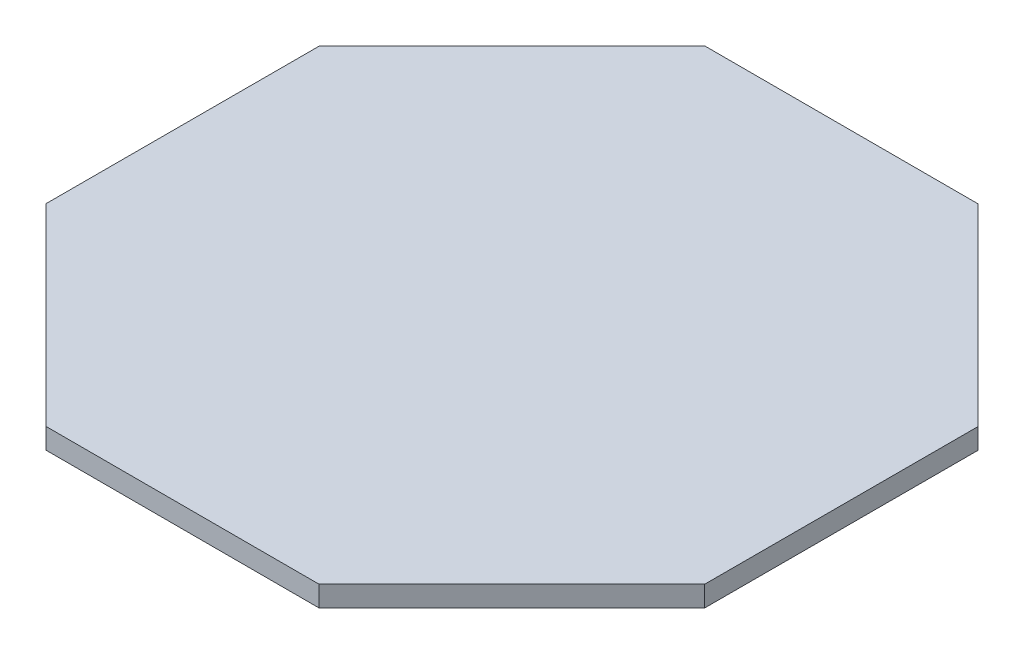
from build123d import *

# Parameters (mm, degrees)
BOSS_EXTRUDE3_DEPTH = 6.35


with BuildPart() as part:
    # Sketch2 → Boss-Extrude3 (new body)
    with BuildSketch(Plane(origin=(0, 0, 0), x_dir=(1, 0, 0), z_dir=(0, 1, 0))):
        Polygon((101.621122419, 42.033067667), (42.135117593, 101.578851956), (-42.033067667, 101.621122419), (-101.578851956, 42.135117593), (-101.621122419, -42.033067667), (-42.135117593, -101.578851956), (42.033067667, -101.621122419), (101.578851956, -42.135117593), align=None)
    extrude(amount=BOSS_EXTRUDE3_DEPTH)


solid = part.part
